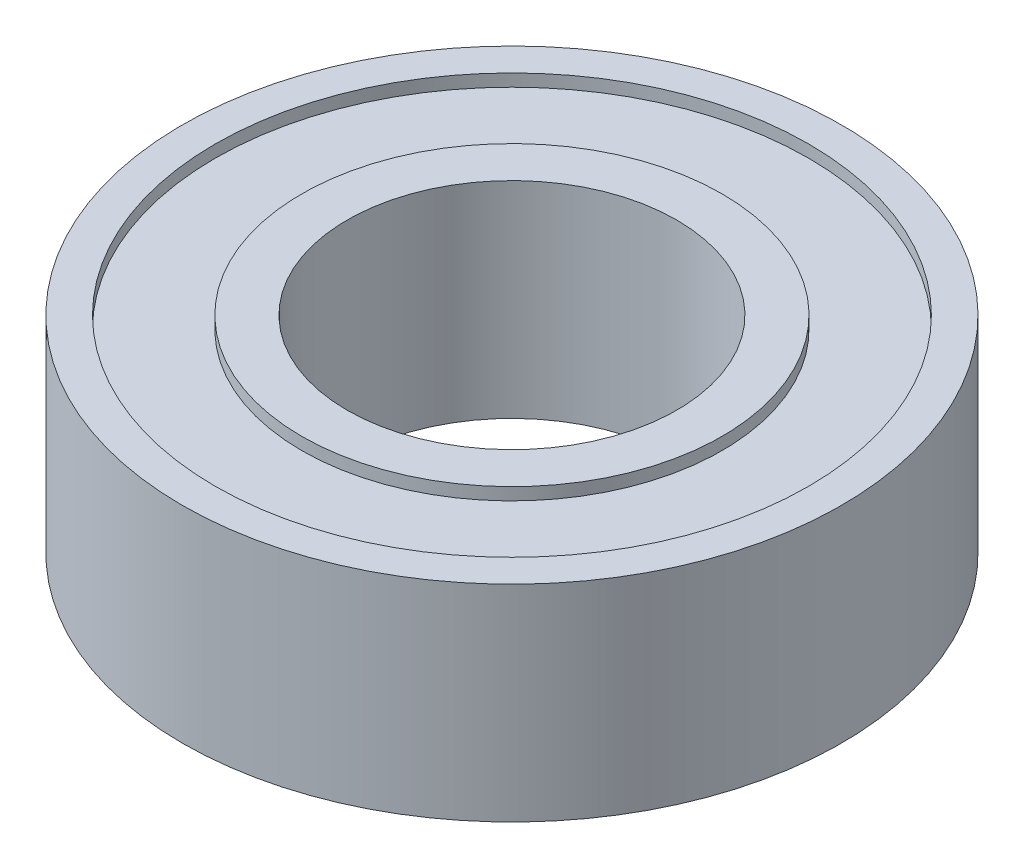
from build123d import *


with BuildPart() as part:
    # Sketch1 → Revolve1 (revolve)
    with BuildSketch(Plane(origin=(0, 0, 0), x_dir=(0, 0, -1), z_dir=(1, 0, 0)), mode=Mode.PRIVATE) as revolve1_sk:
        Polygon((7.2, 2.5), (8, 2.5), (8, -2.5), (7.2, -2.5), (7.2, -2.2), (5.1, -2.2), (5.1, -2.5), (4, -2.5), (4, 2.5), (5.1, 2.5), (5.1, 2.2), (7.2, 2.2), align=None)
    revolve(revolve1_sk.sketch.rotate(Axis((0, 4.825, 0), (0, -1, 0)), 180), axis=Axis((0, 4.825, 0), (0, -1, 0)))


solid = part.part
